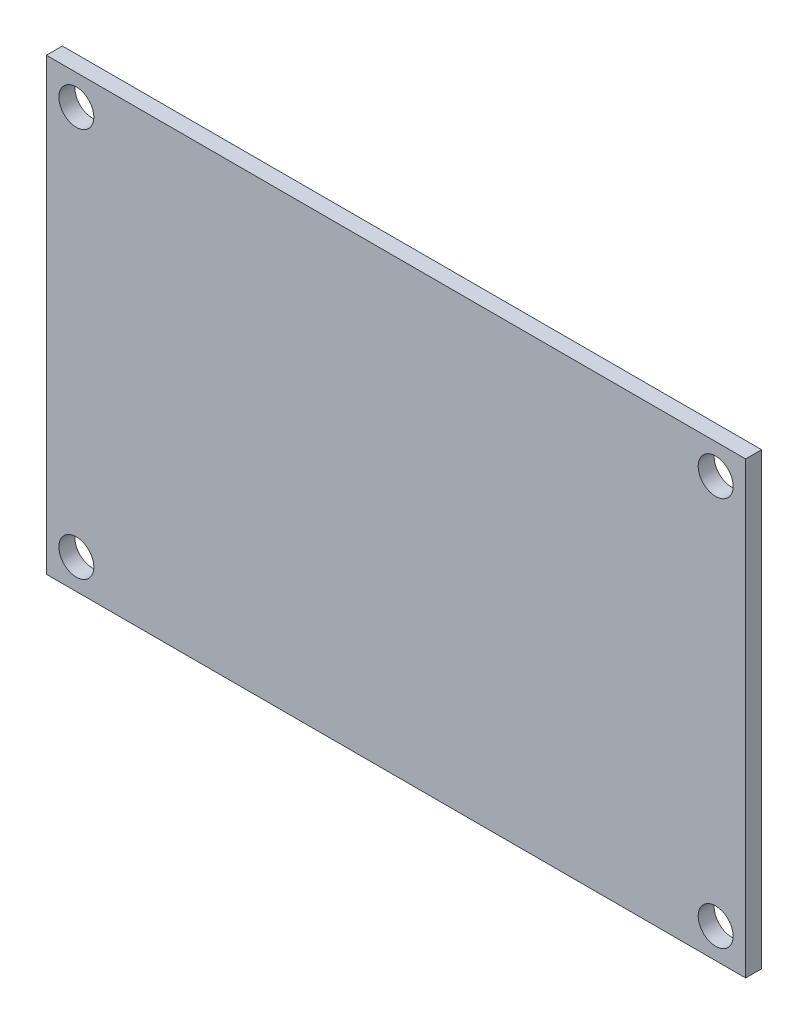
from build123d import *

# Parameters (mm, degrees)
SKETCH1_W               = 70
SKETCH1_H               = 45
BOSS_EXTRUDE1_DEPTH     = 1.6
SKETCH2_R               = 1.75
CUT_EXTRUDE1_DEPTH      = 42.639044177
MIRROR2_COPY_1_SKETCH_R = 1.75
MIRROR2_COPY_1_DEPTH    = 42.639044177


with BuildPart() as part:
    # Sketch1 → Boss-Extrude1 (new body)
    with BuildSketch(Plane.XY):
        Rectangle(SKETCH1_W, SKETCH1_H)
    extrude(amount=BOSS_EXTRUDE1_DEPTH)

    # Sketch2 → Cut-Extrude1 (cut, through all)
    with BuildSketch(Plane.XY.offset(1.6)):
        with Locations((-32, 19.5)):
            Circle(SKETCH2_R)
    cut_extrude1 = extrude(amount=-CUT_EXTRUDE1_DEPTH, mode=Mode.SUBTRACT)

    # Mirror1: Cut-Extrude1 across plane
    add(cut_extrude1.mirror(Plane.ZX), mode=Mode.SUBTRACT)

    # Mirror2: Cut-Extrude1 across plane
    add(cut_extrude1.mirror(Plane(origin=(0, 0, 0), x_dir=(0, 0, 1), z_dir=(1, 0, 0))), mode=Mode.SUBTRACT)

    # Mirror2 copy 1 sketch → Mirror2 copy 1 (cut, through all)
    with BuildSketch(Plane(origin=(0, 0, 1.6), x_dir=(-1, 0, 0), z_dir=(0, 0, 1))):
        with Locations((-32, 19.5)):
            Circle(MIRROR2_COPY_1_SKETCH_R)
    extrude(amount=-MIRROR2_COPY_1_DEPTH, mode=Mode.SUBTRACT)


solid = part.part
